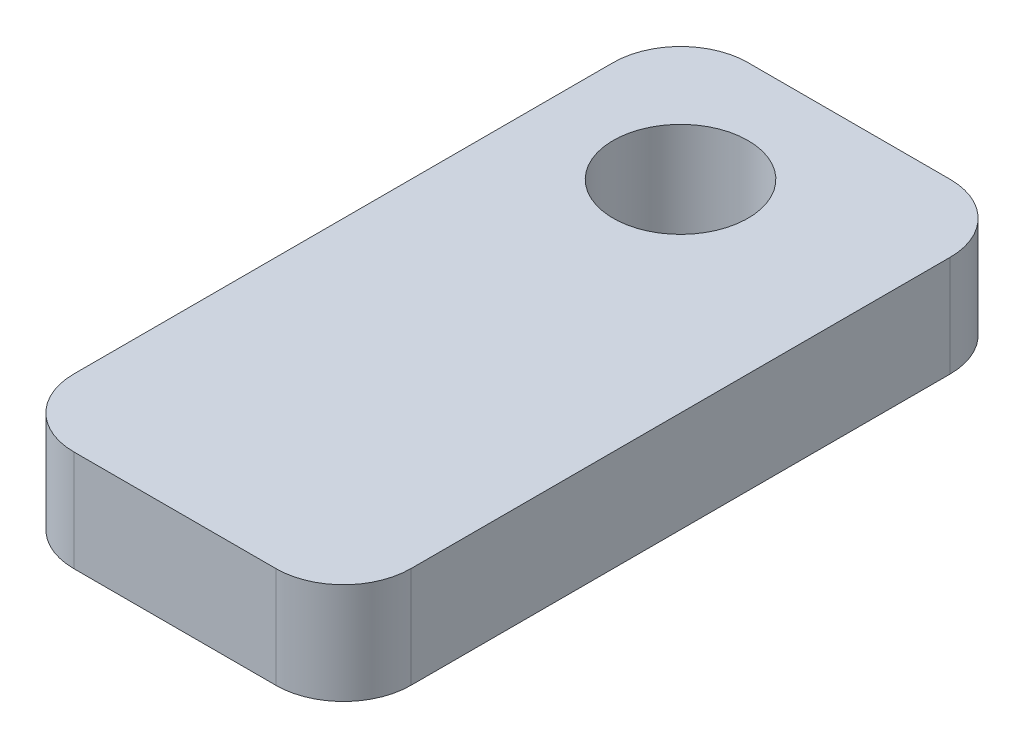
from build123d import *

# Parameters (mm, degrees)
SKETCH1_W           = 6.35
SKETCH1_H           = 12.7
SKETCH1_R           = 1.27
BOSS_EXTRUDE1_DEPTH = 1.905
FILLET1_R           = 1.27


with BuildPart() as part:
    # Sketch1 → Boss-Extrude1 (new body)
    with BuildSketch(Plane(origin=(0, 0, 0), x_dir=(1, 0, 0), z_dir=(0, 1, 0))):
        with Locations((0.635, -3.81)):
            Rectangle(SKETCH1_W, SKETCH1_H)
        with Locations(Location((0, 0, 0), (0, 0, 90))):
            Circle(SKETCH1_R, mode=Mode.SUBTRACT)
    extrude(amount=BOSS_EXTRUDE1_DEPTH)

    # Fillet1
    fillet1_edges = [part.edges().sort_by_distance(p)[0] for p in [
        (-2.54, 0.9525, -2.54),
        (3.81, 0.9525, -2.54),
        (3.81, 0.9525, 10.16),
        (-2.54, 0.9525, 10.16),
    ]]
    fillet(fillet1_edges, radius=FILLET1_R)


solid = part.part
